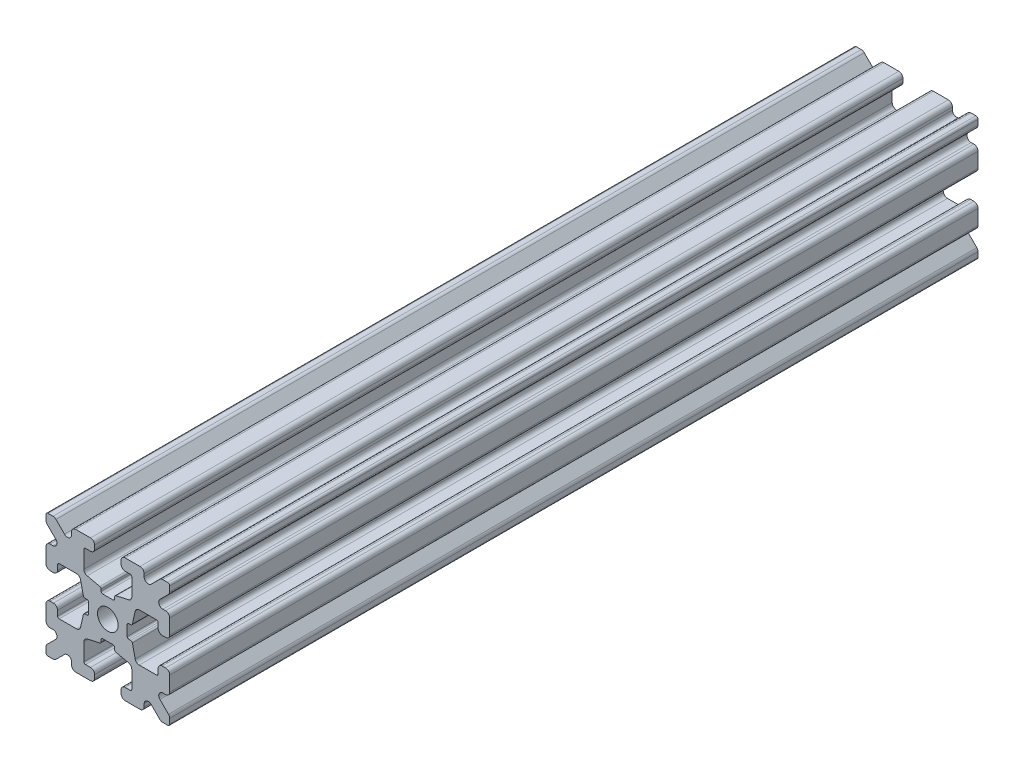
from build123d import *

# Parameters (mm, degrees)
SKETCH1_W           = 15
SKETCH1_H           = 15
SKETCH1_R           = 1.25
BOSS_EXTRUDE1_DEPTH = 49
FILLET1_R           = 0.25
CUT_EXTRUDE1_DEPTH  = 99.572308485
CUT_EXTRUDE3_DEPTH  = 99.572308485
FILLET3_R           = 0.5
FILLET4_R           = 0.5
FILLET5_R           = 3
FILLET6_R           = 0.2
CUT_EXTRUDE4_DEPTH  = 99.572308485
FILLET8_R           = 0.5
SKETCH6_W           = 5.1529354
SKETCH6_H           = 1.651
SKETCH6_W_2         = 1.651
SKETCH6_H_2         = 5.1529354
CUT_EXTRUDE5_DEPTH  = 99.572308485
FILLET10_R          = 0.2


with BuildPart() as part:
    # Sketch1 → Boss-Extrude1 (new, symmetric)
    with BuildSketch(Plane.XY):
        Rectangle(SKETCH1_W, SKETCH1_H)
        Circle(SKETCH1_R, mode=Mode.SUBTRACT)
    extrude(amount=BOSS_EXTRUDE1_DEPTH, both=True)

    # Fillet1
    fillet1_edges = [part.edges().sort_by_distance(p)[0] for p in [
        (7.5, -7.5, 0),
        (-7.5, -7.5, 0),
        (-7.5, 7.5, 0),
        (7.5, 7.5, 0),
    ]]
    fillet(fillet1_edges, radius=FILLET1_R)

    # Sketch2 → Cut-Extrude1 (cut, through all)
    with BuildSketch(Plane.XY.offset(49)):
        Polygon((-7.5, 1.6), (-6.1, 1.6), (-6.1, 2.9), (-3.4, 2.9), (-3.4, -2.9), (-6.1, -2.9), (-6.1, -1.6), (-7.5, -1.6), align=None)
        Polygon((2.9, 6.1), (1.6, 6.1), (1.6, 7.5), (-1.6, 7.5), (-1.6, 6.1), (-2.9, 6.1), (-2.9, 3.4), (2.9, 3.4), align=None)
        Polygon((-1.6, -7.5), (-1.6, -6.1), (-2.9, -6.1), (-2.9, -3.4), (2.9, -3.4), (2.9, -6.1), (1.6, -6.1), (1.6, -7.5), align=None)
        Polygon((6.1, -2.9), (6.1, -1.6), (7.5, -1.6), (7.5, 1.6), (6.1, 1.6), (6.1, 2.9), (3.4, 2.9), (3.4, -2.9), align=None)
    extrude(amount=-CUT_EXTRUDE1_DEPTH, mode=Mode.SUBTRACT)

    # Sketch4 → Cut-Extrude3 (cut, through all)
    with BuildSketch(Plane.XY.offset(49)):
        Polygon((-3.4, 2.9), (-2.75, 0), (-3.4, -2.9), align=None)
        Polygon((-2.9, 3.4), (0, 2.75), (2.9, 3.4), align=None)
        Polygon((3.4, 2.9), (2.75, 0), (3.4, -2.9), align=None)
        Polygon((-2.9, -3.4), (0, -2.75), (2.9, -3.4), align=None)
    extrude(amount=-CUT_EXTRUDE3_DEPTH, mode=Mode.SUBTRACT)

    # Fillet3
    fillet3_edges = [part.edges().sort_by_distance(p)[0] for p in [
        (1.6, -7.5, 0),
        (-1.6, -7.5, 0),
        (-1.6, -6.1, 0),
        (1.6, -6.1, 0),
        (6.1, 1.6, 0),
        (7.5, 1.6, 0),
        (7.5, -1.6, 0),
        (6.1, -1.6, 0),
        (-7.5, -1.6, 0),
        (-7.5, 1.6, 0),
        (-6.1, 1.6, 0),
        (-6.1, -1.6, 0),
        (-1.6, 6.1, 0),
        (-1.6, 7.5, 0),
        (1.6, 7.5, 0),
        (1.6, 6.1, 0),
    ]]
    fillet(fillet3_edges, radius=FILLET3_R)

    # Fillet4
    fillet4_edges = [part.edges().sort_by_distance(p)[0] for p in [
        (-2.9, -3.4, 0),
        (2.9, -3.4, 0),
        (3.4, -2.9, 0),
        (3.4, 2.9, 0),
        (-3.4, 2.9, 0),
        (-3.4, -2.9, 0),
        (2.9, 3.4, 0),
        (-2.9, 3.4, 0),
    ]]
    fillet(fillet4_edges, radius=FILLET4_R)

    # Fillet5
    fillet5_edges = [part.edges().sort_by_distance(p)[0] for p in [
        (-2.75, 0, 0),
        (0, 2.75, 0),
        (2.75, 0, 0),
        (0, -2.75, 0),
    ]]
    fillet(fillet5_edges, radius=FILLET5_R)

    # Fillet6
    fillet6_edges = [part.edges().sort_by_distance(p)[0] for p in [
        (-2.9, -6.1, 0),
        (2.9, -6.1, 0),
        (6.1, -2.9, 0),
        (6.1, 2.9, 0),
        (-6.1, 2.9, 0),
        (-6.1, -2.9, 0),
        (2.9, 6.1, 0),
        (-2.9, 6.1, 0),
    ]]
    fillet(fillet6_edges, radius=FILLET6_R)

    # Sketch5 → Cut-Extrude4 (cut, through all)
    with BuildSketch(Plane.XY.offset(49)):
        Polygon((-7.5, 6.439339828), (-5.460660172, 4.4), (-7.5, 4.4), align=None)
        Polygon((-6.439339828, 7.5), (-4.4, 5.460660172), (-4.4, 7.5), align=None)
        Polygon((4.4, 7.5), (6.439339828, 7.5), (4.4, 5.460660172), align=None)
        Polygon((7.5, 6.439339828), (7.5, 4.4), (5.460660172, 4.4), align=None)
        Polygon((7.5, -6.439339828), (5.460660172, -4.4), (7.5, -4.4), align=None)
        Polygon((6.439339828, -7.5), (4.4, -5.460660172), (4.4, -7.5), align=None)
        Polygon((-4.4, -7.5), (-6.439339828, -7.5), (-4.4, -5.460660172), align=None)
        Polygon((-7.5, -6.439339828), (-7.5, -4.4), (-5.460660172, -4.4), align=None)
    extrude(amount=-CUT_EXTRUDE4_DEPTH, mode=Mode.SUBTRACT)

    # Fillet8
    fillet8_edges = [part.edges().sort_by_distance(p)[0] for p in [
        (-7.5, 4.4, 0),
        (-7.5, 6.439339828, 0),
        (-5.460660172, 4.4, 0),
        (7.5, -4.4, 0),
        (7.5, -6.439339828, 0),
        (5.460660172, -4.4, 0),
        (5.460660172, 4.4, 0),
        (7.5, 6.439339828, 0),
        (7.5, 4.4, 0),
        (-4.4, 7.5, 0),
        (-4.4, 5.460660172, 0),
        (-6.439339828, 7.5, 0),
        (-5.460660172, -4.4, 0),
        (-7.5, -6.439339828, 0),
        (-7.5, -4.4, 0),
        (4.4, 5.460660172, 0),
        (4.4, 7.5, 0),
        (6.439339828, 7.5, 0),
        (6.439339828, -7.5, 0),
        (4.4, -7.5, 0),
        (4.4, -5.460660172, 0),
        (-6.439339828, -7.5, 0),
        (-4.4, -5.460660172, 0),
        (-4.4, -7.5, 0),
    ]]
    fillet(fillet8_edges, radius=FILLET8_R)

    # Sketch6 → Cut-Extrude5 (cut, through all)
    with BuildSketch(Plane.XY.offset(49)):
        with Locations((4.9235323, 0)):
            Rectangle(SKETCH6_W, SKETCH6_H)
        with Locations((0, -4.9235323)):
            Rectangle(SKETCH6_W_2, SKETCH6_H_2)
        with Locations((-4.9235323, 0)):
            Rectangle(SKETCH6_W, SKETCH6_H)
        with Locations((0, 4.9235323)):
            Rectangle(SKETCH6_W_2, SKETCH6_H_2)
    extrude(amount=-CUT_EXTRUDE5_DEPTH, mode=Mode.SUBTRACT)

    # Fillet10
    fillet10_edges = [part.edges().sort_by_distance(p)[0] for p in [
        (0.8255, -2.935025862, 0),
        (-0.8255, -2.935025862, 0),
        (0.8255, -2.3470646, 0),
        (-0.8255, -2.3470646, 0),
        (2.935025862, 0.8255, 0),
        (2.935025862, -0.8255, 0),
        (2.3470646, 0.8255, 0),
        (2.3470646, -0.8255, 0),
        (-2.935025862, -0.8255, 0),
        (-2.935025862, 0.8255, 0),
        (-2.3470646, -0.8255, 0),
        (-2.3470646, 0.8255, 0),
        (-0.8255, 2.935025862, 0),
        (0.8255, 2.935025862, 0),
        (-0.8255, 2.3470646, 0),
        (0.8255, 2.3470646, 0),
    ]]
    fillet(fillet10_edges, radius=FILLET10_R)


solid = part.part
